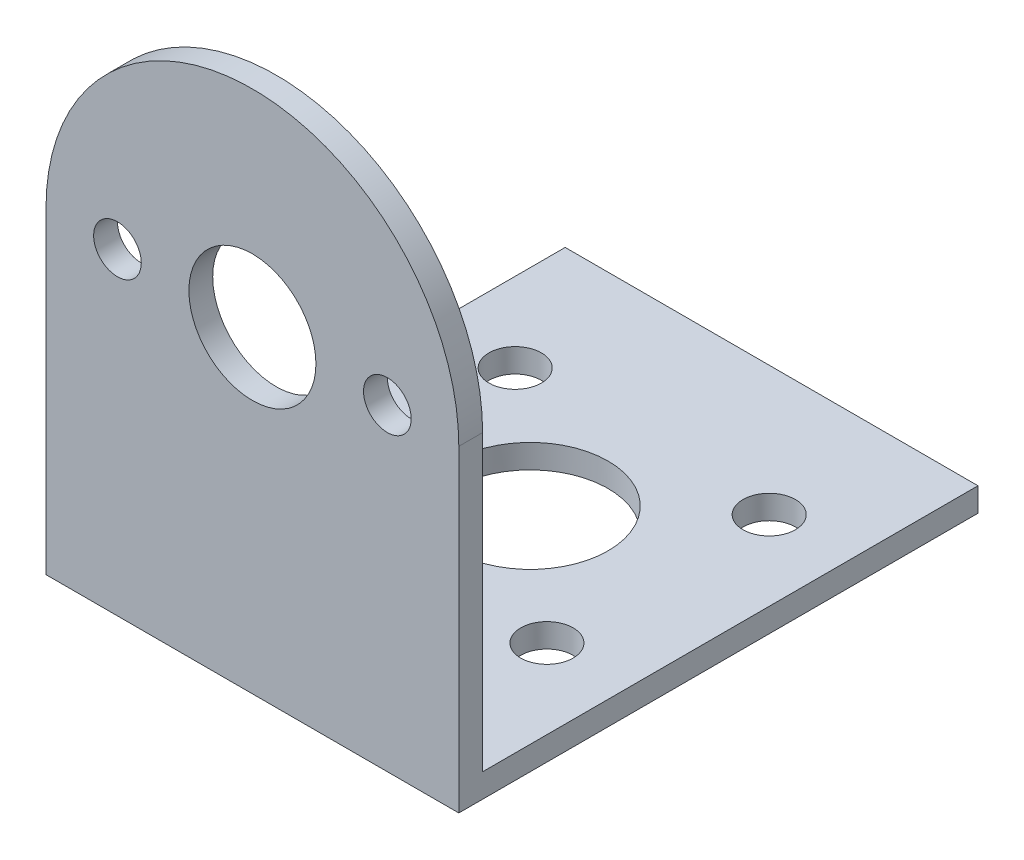
from build123d import *
from build123d.topology import SkipClean

# Parameters (mm, degrees)
SKETCH_1_R          = 4
SKETCH_1_R_2        = 3
EXTRUDE_1_DEPTH     = 3
SKETCH_2_R          = 3
SKETCH_2_R_2        = 1.5
EXTRUDE_2_DEPTH     = 1.5
SKETCH_3_W          = 26
SKETCH_3_H          = 29.7
SKETCH_3_R          = 4.9
SKETCH_3_R_2        = 1.65
EXTRUDE_3_DEPTH     = 3.3
SKETCH_5_R          = 3
SKETCH_5_R_2        = 1.5
EXTRUDE_4_DEPTH     = 1.5
SKETCH_6_R          = 4
SKETCH_6_R_2        = 1.5
CUT_EXTRUDE_1_DEPTH = 1.8
CUT_EXTRUDE_START   = -1.8
SKETCH_7_W          = 26
SKETCH_7_H          = 31.5
SKETCH_7_R          = 4.9
SKETCH_7_R_2        = 1.65
CUT_EXTRUDE_2_DEPTH = 1.8
EXTRUDE_START       = 0.3
SKETCH_11_R         = 4
SKETCH_11_R_2       = 1.5
EXTRUDE_5_DEPTH     = 0.3


with BuildPart() as part:
    # 草图1 → 凸台-拉伸1 (new body)
    with BuildSketch(Plane.XY):
        with BuildLine():
            Line((-13, 0), (-13, -20))
            Line((-13, -20), (13, -20))
            Line((13, -20), (13, 0))
            ThreePointArc((13, 0), (0, 13), (-13, 0))
        make_face()
        Circle(SKETCH_1_R, mode=Mode.SUBTRACT)
        with Locations((8.5, 0)):
            Circle(SKETCH_1_R_2, mode=Mode.SUBTRACT)
        with Locations((-8.5, 0)):
            Circle(SKETCH_1_R_2, mode=Mode.SUBTRACT)
    extrude(amount=EXTRUDE_1_DEPTH)

    # 草图2 → 凸台-拉伸2 (add)
    # profile 1 of 2: a face of its own
    with BuildSketch(Plane(origin=(0, 0, 0), x_dir=(-1, 0, 0), z_dir=(0, 0, -1))):
        with Locations((8.5, 0)):
            Circle(SKETCH_2_R)
        with Locations((8.5, 0)):
            Circle(SKETCH_2_R_2, mode=Mode.SUBTRACT)
    # profile 2 of 2: a face of its own
    with BuildSketch(Plane(origin=(0, 0, 0), x_dir=(-1, 0, 0), z_dir=(0, 0, -1))):
        with Locations((-8.5, 0)):
            Circle(SKETCH_2_R)
        with Locations((-8.5, 0)):
            Circle(SKETCH_2_R_2, mode=Mode.SUBTRACT)
    extrude(amount=-EXTRUDE_2_DEPTH)

    # 草图3 → 凸台-拉伸3 (add)
    with BuildSketch(Plane.XZ.offset(20)):
        with Locations((0, -14.85)):
            Rectangle(SKETCH_3_W, SKETCH_3_H)
        with Locations((0, -14.5)):
            Circle(SKETCH_3_R, mode=Mode.SUBTRACT)
        with Locations((-8, -21.55)):
            Circle(SKETCH_3_R_2, mode=Mode.SUBTRACT)
        with Locations((-8, -7.55)):
            Circle(SKETCH_3_R_2, mode=Mode.SUBTRACT)
        with Locations((8, -7.55)):
            Circle(SKETCH_3_R_2, mode=Mode.SUBTRACT)
        with Locations((8, -21.55)):
            Circle(SKETCH_3_R_2, mode=Mode.SUBTRACT)
    extrude(amount=-EXTRUDE_3_DEPTH)

    # 草图5 → 凸台-拉伸4 (add)
    # profile 1 of 2: a face of its own
    with BuildSketch(Plane.XY.offset(1.5)):
        with Locations((-8.5, 0)):
            Circle(SKETCH_5_R)
        with Locations(Location((-8.5, 0, 0), (0, 0, 180))):
            Circle(SKETCH_5_R_2, mode=Mode.SUBTRACT)
    # profile 2 of 2: a face of its own
    with BuildSketch(Plane.XY.offset(1.5)):
        with Locations((8.5, 0)):
            Circle(SKETCH_5_R)
        with Locations(Location((8.5, 0, 0), (0, 0, 180))):
            Circle(SKETCH_5_R_2, mode=Mode.SUBTRACT)
    extrude(amount=EXTRUDE_4_DEPTH)

    # 草图6 → 切除-拉伸1 (cut)
    with BuildSketch(Plane(origin=(0, 0, 0), x_dir=(-1, 0, 0), z_dir=(0, 0, -1))):
        with BuildLine():
            Line((-13, -16.7), (13, -16.7))
            Line((13, -16.7), (13, 0))
            ThreePointArc((13, 0), (0, 13), (-13, 0))
            Line((-13, 0), (-13, -16.7))
        make_face()
        Circle(SKETCH_6_R, mode=Mode.SUBTRACT)
        with Locations((8.5, 0)):
            Circle(SKETCH_6_R_2, mode=Mode.SUBTRACT)
        with Locations((-8.5, 0)):
            Circle(SKETCH_6_R_2, mode=Mode.SUBTRACT)
    extrude(amount=-CUT_EXTRUDE_1_DEPTH, mode=Mode.SUBTRACT)

    # 草图7 → 切除-拉伸2 (cut)
    with BuildSketch(Plane(origin=(0, -16.7, 0), x_dir=(1, 0, 0), z_dir=(0, 1, 0)).offset(CUT_EXTRUDE_START)):
        with Locations((0, 13.95)):
            Rectangle(SKETCH_7_W, SKETCH_7_H)
        with Locations((0, 14.5)):
            Circle(SKETCH_7_R, mode=Mode.SUBTRACT)
        with Locations((-8, 7.55)):
            Circle(SKETCH_7_R_2, mode=Mode.SUBTRACT)
        with Locations((8, 7.55)):
            Circle(SKETCH_7_R_2, mode=Mode.SUBTRACT)
        with Locations((8, 21.55)):
            Circle(SKETCH_7_R_2, mode=Mode.SUBTRACT)
        with Locations((-8, 21.55)):
            Circle(SKETCH_7_R_2, mode=Mode.SUBTRACT)
    extrude(amount=CUT_EXTRUDE_2_DEPTH, mode=Mode.SUBTRACT)

    # 草图11 → 凸台-拉伸5 (add)
    with SkipClean():  # the faces are left unmerged after this step: merging them gives an invalid solid
        with BuildSketch(Plane(origin=(0, 0, 1.8), x_dir=(-1, 0, 0), z_dir=(0, 0, -1)).offset(EXTRUDE_START)):
            with BuildLine():
                Line((-13, 0), (-13, -18.5))
                Line((-13, -18.5), (13, -18.5))
                Line((13, -18.5), (13, 0))
                ThreePointArc((13, 0), (0, 13), (-13, 0))
            make_face()
            Circle(SKETCH_11_R, mode=Mode.SUBTRACT)
            with Locations((-8.5, 0)):
                Circle(SKETCH_11_R_2, mode=Mode.SUBTRACT)
            with Locations((8.5, 0)):
                Circle(SKETCH_11_R_2, mode=Mode.SUBTRACT)
        extrude(amount=-EXTRUDE_5_DEPTH)


solid = part.part
